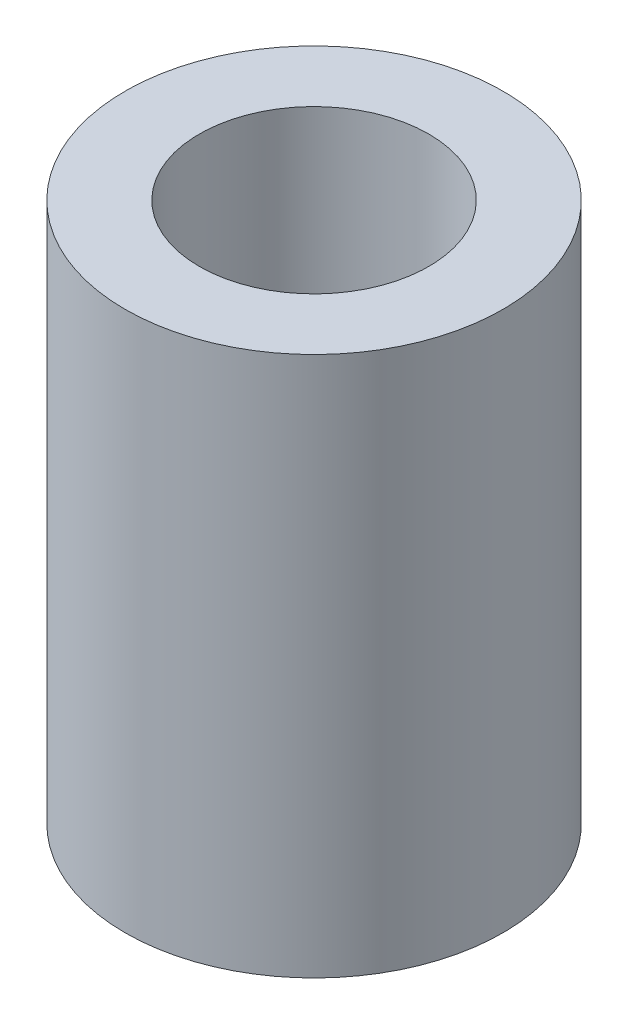
from build123d import *

# Parameters (mm, degrees)
SZKIC1_R                    = 7
SZKIC1_R_2                  = 4.25
DODANIE_WYCI_GNI_CIE1_DEPTH = 10


with BuildPart() as part:
    # Szkic1 → Dodanie-wyciągnięcie1 (new, symmetric)
    with BuildSketch(Plane(origin=(0, 0, 0), x_dir=(1, 0, 0), z_dir=(0, 1, 0))):
        with Locations(Location((0, 0, 0), (0, 0, 270))):
            Circle(SZKIC1_R)
        with Locations(Location((0, 0, 0), (0, 0, 270))):
            Circle(SZKIC1_R_2, mode=Mode.SUBTRACT)
    extrude(amount=DODANIE_WYCI_GNI_CIE1_DEPTH, both=True)


solid = part.part
